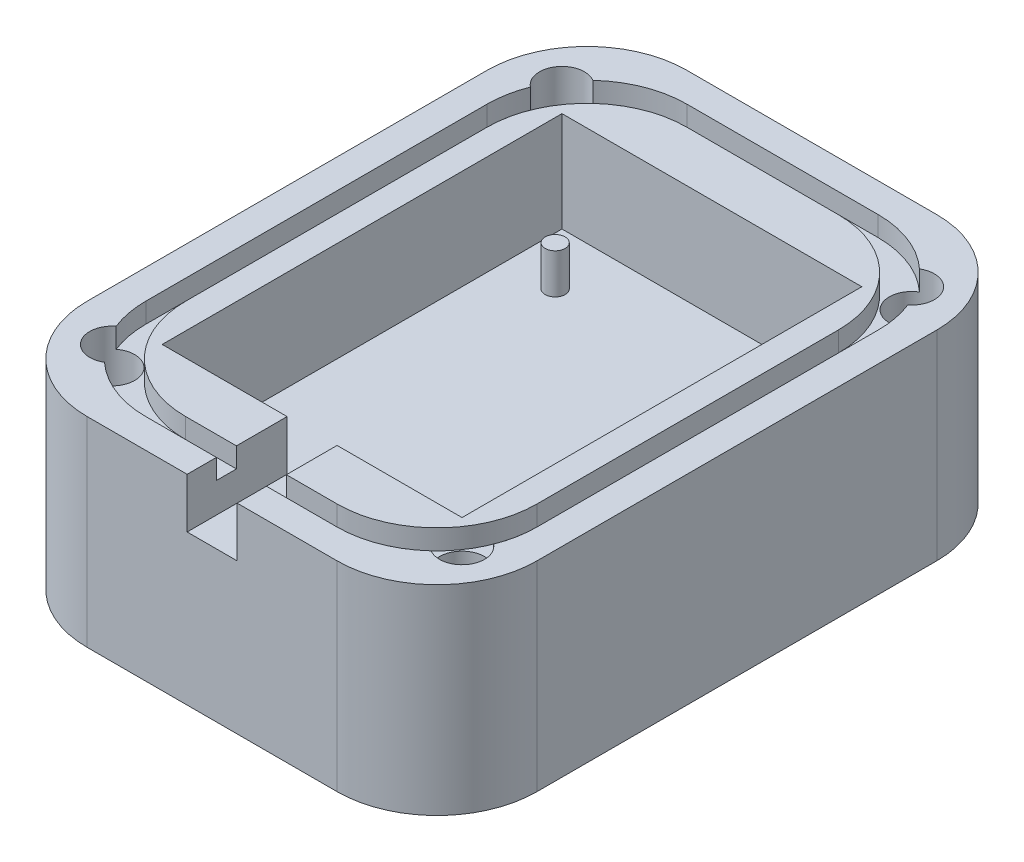
from build123d import *

# Parameters (mm, degrees)
BOSS_EXTRU_1_DEPTH      = 10
ESQUISSE2_W             = 30
ESQUISSE2_H             = 40
BOSS_EXTRU_2_DEPTH      = 10
ESQUISSE3_R             = 1
BOSS_EXTRU_3_DEPTH      = 4
ESQUISSE4_W             = 5
ESQUISSE4_H             = 10
ENL_V_MAT_EXTRU_1_DEPTH = 5
ESQUISSE5_R             = 2.25
ENL_V_MAT_EXTRU_2_DEPTH = 10
CUT_EXTRUDE1_DEPTH      = 2


with BuildPart() as part:
    # Esquisse1 → Boss.-Extru.1 (new body)
    with BuildSketch(Plane(origin=(0, 0, 0), x_dir=(1, 0, 0), z_dir=(0, 1, 0))):
        with BuildLine():
            Line((-12.5, 30), (12.5, 30))
            ThreePointArc((12.5, 30), (19.571067812, 27.071067812), (22.5, 20))
            Line((22.5, 20), (22.5, -20))
            ThreePointArc((22.5, -20), (19.571067812, -27.071067812), (12.5, -30))
            Line((12.5, -30), (-12.5, -30))
            ThreePointArc((-12.5, -30), (-19.571067812, -27.071067812), (-22.5, -20))
            Line((-22.5, -20), (-22.5, 20))
            ThreePointArc((-22.5, 20), (-19.571067812, 27.071067812), (-12.5, 30))
        make_face()
    extrude(amount=BOSS_EXTRU_1_DEPTH)

    # Esquisse2 → Boss.-Extru.2 (add)
    with BuildSketch(Plane(origin=(0, 10, 0), x_dir=(1, 0, 0), z_dir=(0, 1, 0))):
        with BuildLine():
            ThreePointArc((22.5, 20), (19.571067812, 27.071067812), (12.5, 30))
            Line((12.5, 30), (-12.5, 30))
            ThreePointArc((-12.5, 30), (-19.571067812, 27.071067812), (-22.5, 20))
            Line((-22.5, 20), (-22.5, -20))
            ThreePointArc((-22.5, -20), (-19.571067812, -27.071067812), (-12.5, -30))
            Line((-12.5, -30), (12.5, -30))
            ThreePointArc((12.5, -30), (19.571067812, -27.071067812), (22.5, -20))
            Line((22.5, -20), (22.5, 20))
        make_face()
        Rectangle(ESQUISSE2_W, ESQUISSE2_H, mode=Mode.SUBTRACT)
    extrude(amount=BOSS_EXTRU_2_DEPTH)

    # Esquisse3 → Boss.-Extru.3 (add)
    with BuildSketch(Plane(origin=(0, 10, 0), x_dir=(1, 0, 0), z_dir=(0, 1, 0))):
        with Locations(Location((-10.16, 14.478, 0), (0, 0, 270))):
            Circle(ESQUISSE3_R)
        with Locations(Location((10.16, 14.478, 0), (0, 0, 270))):
            Circle(ESQUISSE3_R)
    extrude(amount=BOSS_EXTRU_3_DEPTH)

    # Esquisse4 → Enlèv. mat.-Extru.1 (cut)
    with BuildSketch(Plane(origin=(0, 20, 0), x_dir=(1, 0, 0), z_dir=(0, 1, 0))):
        with Locations((0, -25)):
            Rectangle(ESQUISSE4_W, ESQUISSE4_H)
    extrude(amount=-ENL_V_MAT_EXTRU_1_DEPTH, mode=Mode.SUBTRACT)

    # Esquisse5 → Enlèv. mat.-Extru.2 (cut)
    with BuildSketch(Plane(origin=(0, 20, 0), x_dir=(1, 0, 0), z_dir=(0, 1, 0))):
        with Locations(Location((-17.5, -22.5, 0), (0, 0, 270))):
            Circle(ESQUISSE5_R)
        with Locations(Location((17.5, -22.5, 0), (0, 0, 270))):
            Circle(ESQUISSE5_R)
        with Locations(Location((17.5, 22.5, 0), (0, 0, 270))):
            Circle(ESQUISSE5_R)
        with Locations(Location((-17.5, 22.5, 0), (0, 0, 270))):
            Circle(ESQUISSE5_R)
    extrude(amount=-ENL_V_MAT_EXTRU_2_DEPTH, mode=Mode.SUBTRACT)

    # Sketch1 → Cut-Extrude1 (cut)
    with BuildSketch(Plane(origin=(0, 20, 0), x_dir=(1, 0, 0), z_dir=(0, 1, 0))):
        with BuildLine():
            Line((-9.571067812, 27.071067812), (9.571067812, 27.071067812))
            ThreePointArc((9.571067812, 27.071067812), (13.20533493, 26.387295724), (16.342599965, 24.429488315))
            ThreePointArc((16.342599965, 24.429488315), (15.643481423, 21.228843529), (18.880326672, 20.723149337))
            ThreePointArc((18.880326672, 20.723149337), (19.396865199, 18.929482646), (19.571067812, 17.071067812))
            Line((19.571067812, 17.071067812), (19.571067812, -17.071067812))
            ThreePointArc((19.571067812, -17.071067812), (19.396865199, -18.929482646), (18.880326672, -20.723149337))
            ThreePointArc((18.880326672, -20.723149337), (15.643481423, -21.228843529), (16.342599965, -24.429488315))
            ThreePointArc((16.342599965, -24.429488315), (13.20533493, -26.387295724), (9.571067812, -27.071067812))
            Line((9.571067812, -27.071067812), (-9.571067812, -27.071067812))
            ThreePointArc((-9.571067812, -27.071067812), (-13.20533493, -26.387295724), (-16.342599965, -24.429488315))
            ThreePointArc((-16.342599965, -24.429488315), (-15.643481423, -21.228843529), (-18.880326672, -20.723149337))
            ThreePointArc((-18.880326672, -20.723149337), (-19.396865199, -18.929482646), (-19.571067812, -17.071067812))
            Line((-19.571067812, -17.071067812), (-19.571067812, 17.071067812))
            ThreePointArc((-19.571067812, 17.071067812), (-19.396865199, 18.929482646), (-18.880326672, 20.723149337))
            ThreePointArc((-18.880326672, 20.723149337), (-15.643481423, 21.228843529), (-16.342599965, 24.429488315))
            ThreePointArc((-16.342599965, 24.429488315), (-13.20533493, 26.387295724), (-9.571067812, 27.071067812))
        make_face()
        with BuildLine():
            Line((-7.571067812, 25.071067812), (7.571067812, 25.071067812))
            ThreePointArc((7.571067812, 25.071067812), (14.642135624, 22.142135624), (17.571067812, 15.071067812))
            Line((17.571067812, 15.071067812), (17.571067812, -15.071067812))
            ThreePointArc((17.571067812, -15.071067812), (14.642135624, -22.142135624), (7.571067812, -25.071067812))
            Line((7.571067812, -25.071067812), (-7.571067812, -25.071067812))
            ThreePointArc((-7.571067812, -25.071067812), (-14.642135624, -22.142135624), (-17.571067812, -15.071067812))
            Line((-17.571067812, -15.071067812), (-17.571067812, 15.071067812))
            ThreePointArc((-17.571067812, 15.071067812), (-14.642135624, 22.142135624), (-7.571067812, 25.071067812))
        make_face(mode=Mode.SUBTRACT)
    extrude(amount=-CUT_EXTRUDE1_DEPTH, mode=Mode.SUBTRACT)


solid = part.part
